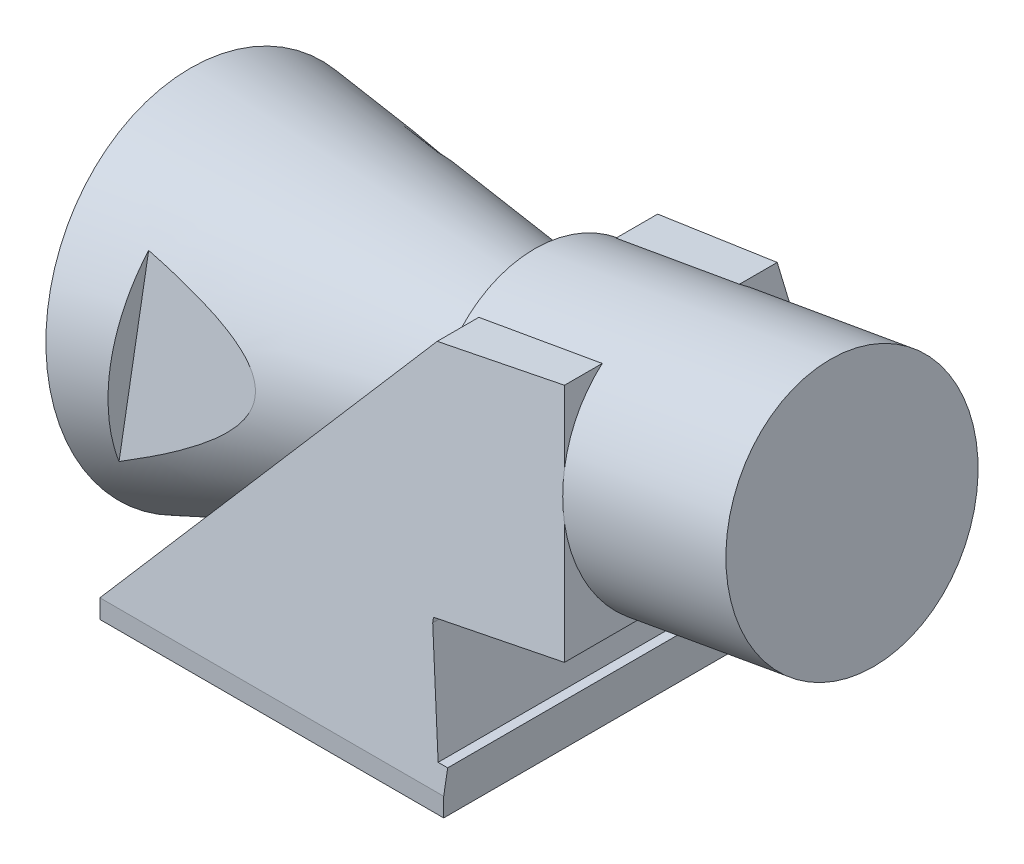
from build123d import *

# Parameters (mm, degrees)
EXTRUDE_1_DEPTH      = 81.5
EXTRUDE_2_DEPTH      = 40
EXTRUDE_2_DEPTH_BACK = 32.5
SKETCH_3_R           = 30
EXTRUDE_3_DEPTH      = 81.5
CUT_EXTRUDE_1_REACH  = 198.129


with BuildPart() as part:
    # 草图2 → 凸台-拉伸1 (new body)
    with BuildSketch(Plane.XY):
        Polygon((0, 0), (83, 0), (75.110468057, 34.237591451), (75.110468057, 35.32376219), (105.780577321, 40.731729955), (97.093810418, 89.996833162), (67.296196513, 84.74270987), (0, 4.542225907), align=None)
    extrude(amount=EXTRUDE_1_DEPTH)

    # 草图3 → 凸台-拉伸2 (add, two sides: drawn at the far end of the back side and taken through both)
    with BuildSketch(Plane(origin=(109.556438685, 19.31775605, 0), x_dir=(0, 0, -1), z_dir=(0.98480775301221, 0.1736481776669192, 0)).offset(-EXTRUDE_2_DEPTH_BACK)):
        with Locations(Location((-40.75, 46.756867386, 0), (0, 0, 90))):
            Circle(SKETCH_3_R)
    extrude(amount=EXTRUDE_2_DEPTH + EXTRUDE_2_DEPTH_BACK)

    # 草图4 → 凸台-拉伸3 (add)
    with BuildSketch(Plane.XY.offset(81.5)):
        Polygon((83, 0), (83, 10), (80.695652174, 10), align=None)
    extrude(amount=-EXTRUDE_3_DEPTH)


with BuildPart() as body_2:
    # 草图5 → 旋转1 (revolve)
    with BuildSketch(Plane.XY.offset(40.75)):
        Polygon((-11.679618663, 44.622998406), (-18.886018036, 85.492520156), (98.968550269, 79.364655133), (101.573272934, 64.592538838), align=None)
    revolve(axis=Axis((101.573272934, 64.592538838, 40.75), (-0.9848077530122099, -0.17364817766691962, 0)))


with BuildPart() as cut_extrude_1_tool:
    # 切除-拉伸1: up to this plane
    cut_extrude_1_end = Plane(origin=(105.780577321, 40.731729955, 81.5), z_dir=(-0.98480775301221, -0.17364817766691973, 0))
    # 草图7 → 切除-拉伸1 (new, up to the surface)
    with BuildSketch(Plane.ZY, mode=Mode.PRIVATE) as cut_extrude_1_sk1:
        Polygon((0, 4.542225907), (15.067952885, 89.996833162), (0, 89.996833162), align=None)
    cut_extrude_1_tool1 = split(extrude(cut_extrude_1_sk1.sketch, amount=-CUT_EXTRUDE_1_REACH, mode=Mode.PRIVATE), bisect_by=cut_extrude_1_end, keep=Keep.BOTH, mode=Mode.PRIVATE)
    add(cut_extrude_1_tool1.solids().sort_by_distance((0, 61.511964, 5.022651))[0])
    # 草图7 → 切除-拉伸1 (new, up to the surface)
    with BuildSketch(Plane.ZY, mode=Mode.PRIVATE) as cut_extrude_1_sk2:
        Polygon((81.5, 89.996833162), (81.5, 4.542225907), (66.432047115, 89.996833162), align=None)
    cut_extrude_1_tool2 = split(extrude(cut_extrude_1_sk2.sketch, amount=-CUT_EXTRUDE_1_REACH, mode=Mode.PRIVATE), bisect_by=cut_extrude_1_end, keep=Keep.BOTH, mode=Mode.PRIVATE)
    add(cut_extrude_1_tool2.solids().sort_by_distance((0, 61.511964, 76.477349))[0])


with BuildPart() as part_1:
    add(part.part)

    # 切除-拉伸1: cut by cut_extrude_1_tool
    add(cut_extrude_1_tool.part, mode=Mode.SUBTRACT)


with BuildPart() as body_2_1:
    add(body_2.part)

    # 切除-拉伸1: cut by cut_extrude_1_tool
    add(cut_extrude_1_tool.part, mode=Mode.SUBTRACT)


solid = Compound([part_1.part, body_2_1.part])
